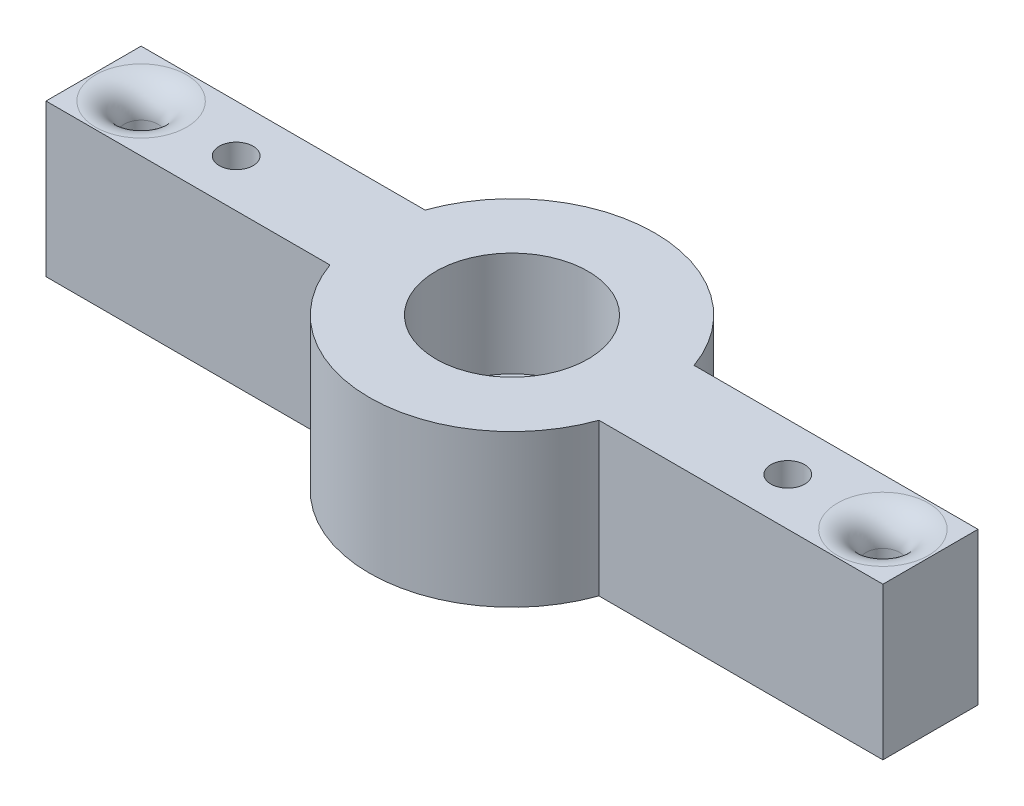
from build123d import *

# Parameters (mm, degrees)
SKETCH1_R           = 0.889
SKETCH1_R_2         = 1.875
BOSS_EXTRUDE1_DEPTH = 8
SKETCH2_R           = 4
CUT_EXTRUDE1_DEPTH  = 5.5
FILLET1_R           = 1.5


with BuildPart() as part:
    # Sketch1 → Boss-Extrude1 (new body)
    with BuildSketch(Plane(origin=(0, 0, 0), x_dir=(1, 0, 0), z_dir=(0, 1, 0))):
        with BuildLine():
            Line((-7.071067812, 2.5), (-22, 2.5))
            Line((-22, 2.5), (-22, -2.5))
            Line((-22, -2.5), (-7.071067812, -2.5))
            ThreePointArc((-7.071067812, -2.5), (0, -7.5), (7.071067812, -2.5))
            Line((7.071067812, -2.5), (22, -2.5))
            Line((22, -2.5), (22, 2.5))
            Line((22, 2.5), (7.071067812, 2.5))
            ThreePointArc((7.071067812, 2.5), (0, 7.5), (-7.071067812, 2.5))
        make_face()
        with Locations(Location((-19.5, 0, 0), (0, 0, 270))):
            Circle(SKETCH1_R, mode=Mode.SUBTRACT)
        with Locations(Location((0, 0, 0), (0, 0, 270))):
            Circle(SKETCH1_R_2, mode=Mode.SUBTRACT)
        with Locations(Location((19.5, 0, 0), (0, 0, 270))):
            Circle(SKETCH1_R, mode=Mode.SUBTRACT)
        with Locations(Location((-14.5, 0, 0), (0, 0, 270))):
            Circle(SKETCH1_R, mode=Mode.SUBTRACT)
        with Locations(Location((14.5, 0, 0), (0, 0, 270))):
            Circle(SKETCH1_R, mode=Mode.SUBTRACT)
    extrude(amount=BOSS_EXTRUDE1_DEPTH)

    # Sketch2 → Cut-Extrude1 (cut)
    with BuildSketch(Plane(origin=(0, 8, 0), x_dir=(1, 0, 0), z_dir=(0, 1, 0))):
        with Locations(Location((0, 0, 0), (0, 0, 270))):
            Circle(SKETCH2_R)
    extrude(amount=-CUT_EXTRUDE1_DEPTH, mode=Mode.SUBTRACT)

    # Fillet1
    fillet1_edges = [part.edges().sort_by_distance(p)[0] for p in [
        (-19.5, 8, -0.889),
        (19.5, 8, -0.889),
    ]]
    fillet(fillet1_edges, radius=FILLET1_R)


solid = part.part
